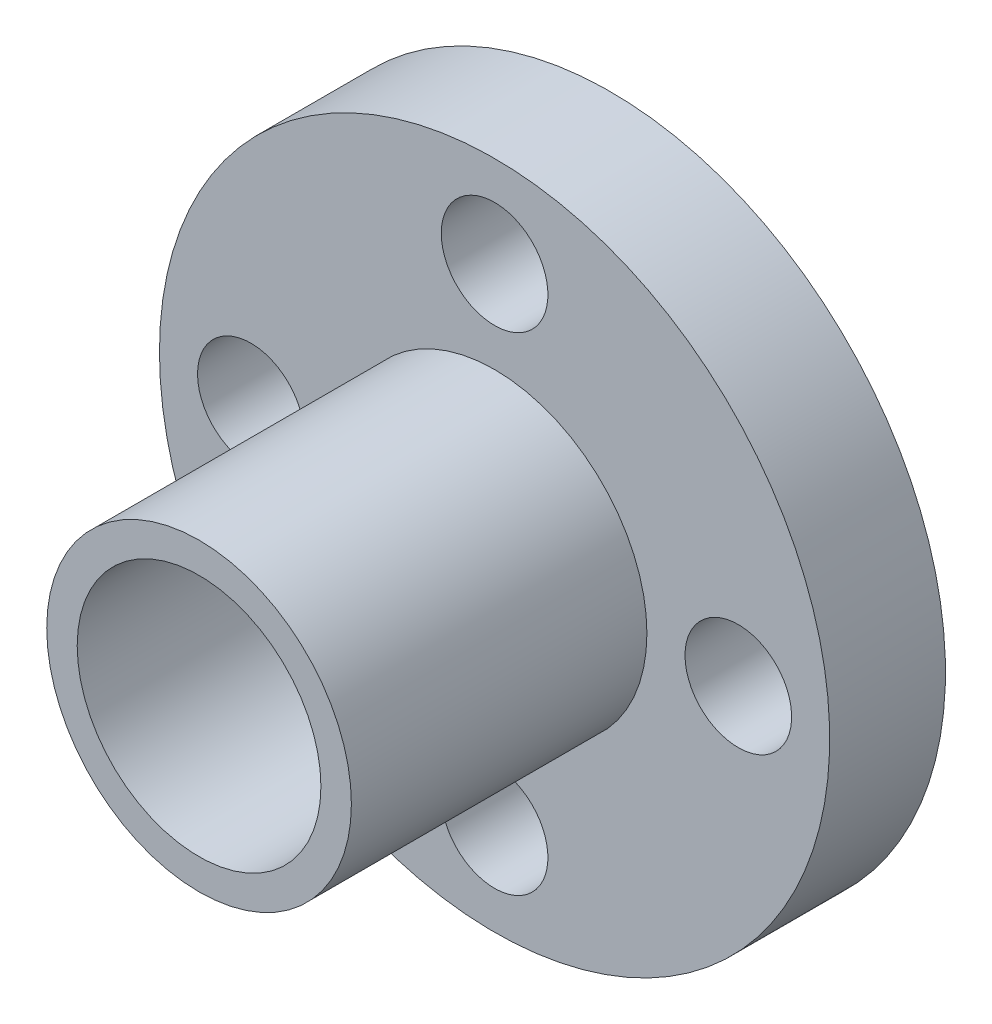
from build123d import *

# Parameters (mm, degrees)
SKETCH_1_R      = 11
SKETCH_1_R_2    = 5
SKETCH_1_R_3    = 1.75
EXTRUDE_1_DEPTH = 3.8
EXTRUDE_START   = 1.5
SKETCH_2_R      = 5
SKETCH_2_R_2    = 4
EXTRUDE_2_DEPTH = 15


with BuildPart() as part:
    # 草图1 → 凸台-拉伸1 (new body)
    with BuildSketch(Plane.XY):
        with Locations(Location((0, 0, 0), (0, 0, 180))):
            Circle(SKETCH_1_R)
        with Locations(Location((0, 0, 0), (0, 0, 180))):
            Circle(SKETCH_1_R_2, mode=Mode.SUBTRACT)
        with Locations(Location((-8, 0, 0), (0, 0, 180))):
            Circle(SKETCH_1_R_3, mode=Mode.SUBTRACT)
        with Locations(Location((0, 8, 0), (0, 0, 180))):
            Circle(SKETCH_1_R_3, mode=Mode.SUBTRACT)
        with Locations(Location((8, 0, 0), (0, 0, 180))):
            Circle(SKETCH_1_R_3, mode=Mode.SUBTRACT)
        with Locations(Location((0, -8, 0), (0, 0, 180))):
            Circle(SKETCH_1_R_3, mode=Mode.SUBTRACT)
    extrude(amount=EXTRUDE_1_DEPTH)

    # 草图2 → 凸台-拉伸2 (add)
    with BuildSketch(Plane(origin=(0, 0, 0), x_dir=(-1, 0, 0), z_dir=(0, 0, -1)).offset(EXTRUDE_START)):
        Circle(SKETCH_2_R)
        Circle(SKETCH_2_R_2, mode=Mode.SUBTRACT)
    extrude(amount=-EXTRUDE_2_DEPTH)


solid = part.part
